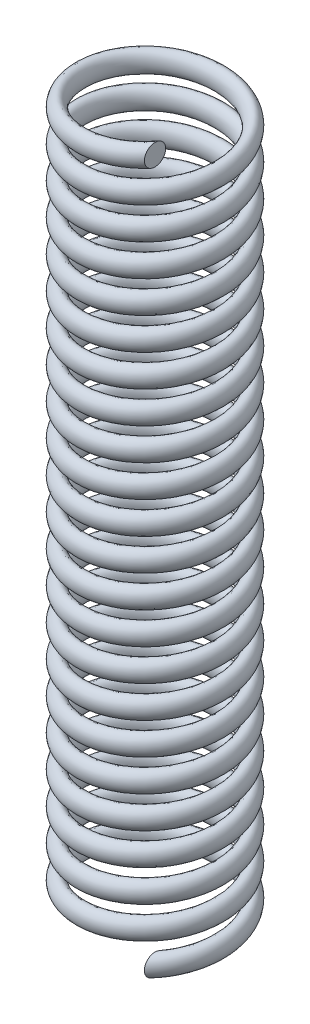
from build123d import *

# Parameters (mm, degrees)
SWEEP1_PITCH       = 1.5
SWEEP1_HEIGHT      = 33
SWEEP1_RADIUS      = 3.25
SWEEP1_START_ANGLE = 135
SKETCH3_R          = 0.5


with BuildPart() as part:
    # Sweep1: sweep along a helix
    with BuildLine() as sweep1_path:
        add(Helix(SWEEP1_PITCH, SWEEP1_HEIGHT, SWEEP1_RADIUS, center=(0, 17.53125, 0), direction=(0, -1, 0), mode=Mode.PRIVATE).rotate(Axis((0, 17.53125, 0), (0, -1, 0)), SWEEP1_START_ANGLE))
    # Sketch3 → Sweep1 (sweep)
    with BuildSketch(Plane(origin=(2.298097039, 0, 0), x_dir=(0, 0, -1), z_dir=(1, 0, 0))):
        with Locations((-2.298097039, 17.53125)):
            Circle(SKETCH3_R)
    sweep(path=sweep1_path.line, is_frenet=True)


solid = part.part
